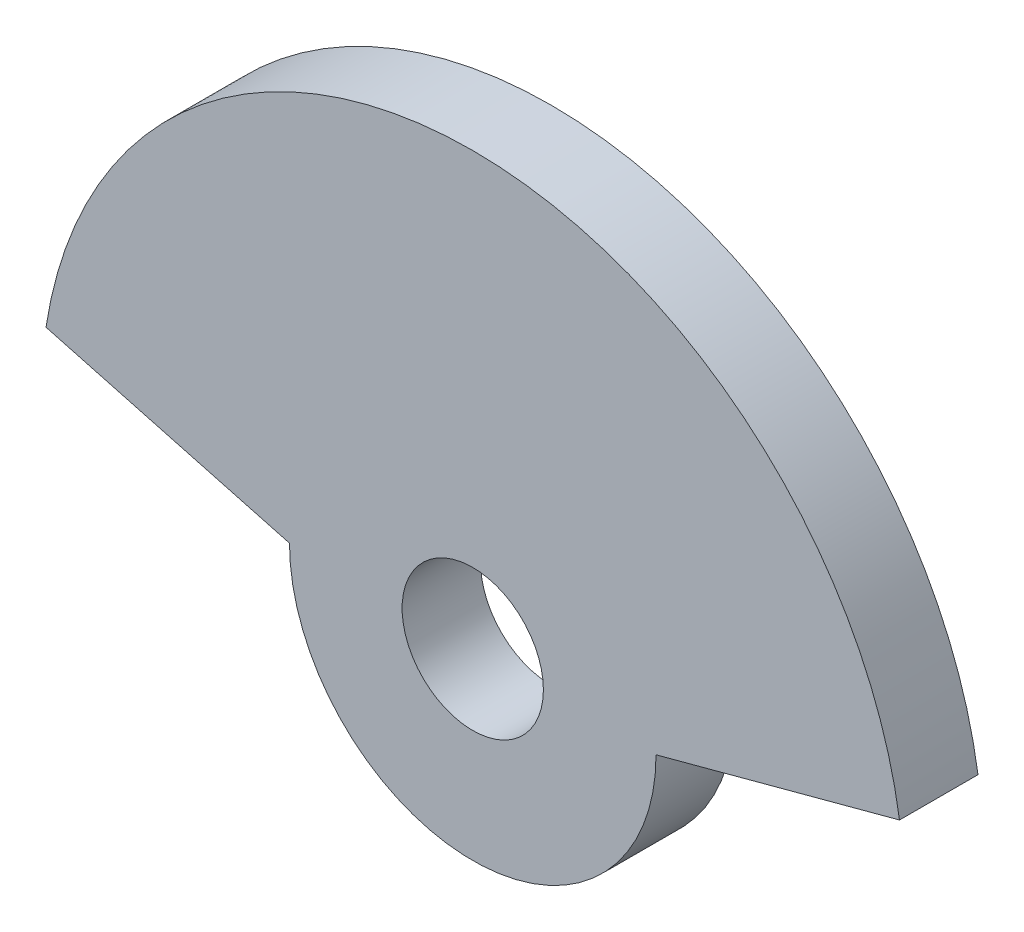
from build123d import *

# Parameters (mm, degrees)
SZKIC1_R                    = 9
DODANIE_WYCI_GNI_CIE1_DEPTH = 10


with BuildPart() as part:
    # Szkic1 → Dodanie-wyciągnięcie1 (new body)
    with BuildSketch(Plane.XY):
        with BuildLine():
            Line((-23.35, 0), (-54.368386356, 8.311351575))
            ThreePointArc((-54.368386356, 8.311351575), (0, 55), (54.368386356, 8.311351575))
            Line((54.368386356, 8.311351575), (23.35, 0))
            ThreePointArc((23.35, 0), (0, -23.35), (-23.35, 0))
        make_face()
        Circle(SZKIC1_R, mode=Mode.SUBTRACT)
    extrude(amount=DODANIE_WYCI_GNI_CIE1_DEPTH)


solid = part.part
